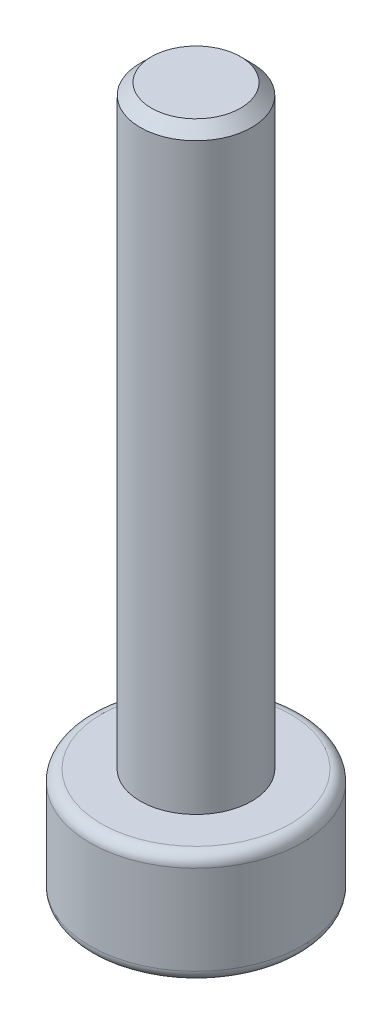
from build123d import *

# Parameters (mm, degrees)
SKETCH_1_R          = 2.85
EXTRUDE_1_DEPTH     = 3
SKETCH_2_R          = 1.5
EXTRUDE_2_DEPTH     = 16
SKETCH_3_R          = 1.29
CUT_EXTRUDE_1_DEPTH = 1.3
FILLET_1_R          = 0.3
CHAMFER_1_SIZE      = 0.3
CHAMFER_2_SIZE      = 0.15


with BuildPart() as part:
    # 草图1 → 凸台-拉伸1 (new body)
    with BuildSketch(Plane(origin=(0, 0, 0), x_dir=(1, 0, 0), z_dir=(0, 1, 0))):
        with Locations(Location((0, 0, 0), (0, 0, 270))):
            Circle(SKETCH_1_R)
    extrude(amount=EXTRUDE_1_DEPTH)

    # 草图2 → 凸台-拉伸2 (add)
    with BuildSketch(Plane(origin=(0, 3, 0), x_dir=(1, 0, 0), z_dir=(0, 1, 0))):
        with Locations(Location((0, 0, 0), (0, 0, 270))):
            Circle(SKETCH_2_R)
    extrude(amount=EXTRUDE_2_DEPTH)

    # 草图3 → 切除-拉伸1 (cut)
    with BuildSketch(Plane.XZ):
        with Locations(Location((0, 0, 0), (0, 0, 270))):
            Circle(SKETCH_3_R)
    extrude(amount=-CUT_EXTRUDE_1_DEPTH, mode=Mode.SUBTRACT)

    # 圆角1
    fillet_1_edges = [part.edges().sort_by_distance(p)[0] for p in [
        (0, 0, -2.85),
        (0, 3, -2.85),
    ]]
    fillet(fillet_1_edges, radius=FILLET_1_R)

    # 倒角1
    chamfer_1_edges = [part.edges().sort_by_distance(p)[0] for p in [
        (0, 19, -1.5),
    ]]
    chamfer(chamfer_1_edges, length=CHAMFER_1_SIZE)

    # 倒角2
    chamfer_2_edges = [part.edges().sort_by_distance(p)[0] for p in [
        (0, 0, 1.29),
    ]]
    chamfer(chamfer_2_edges, length=CHAMFER_2_SIZE)


solid = part.part
